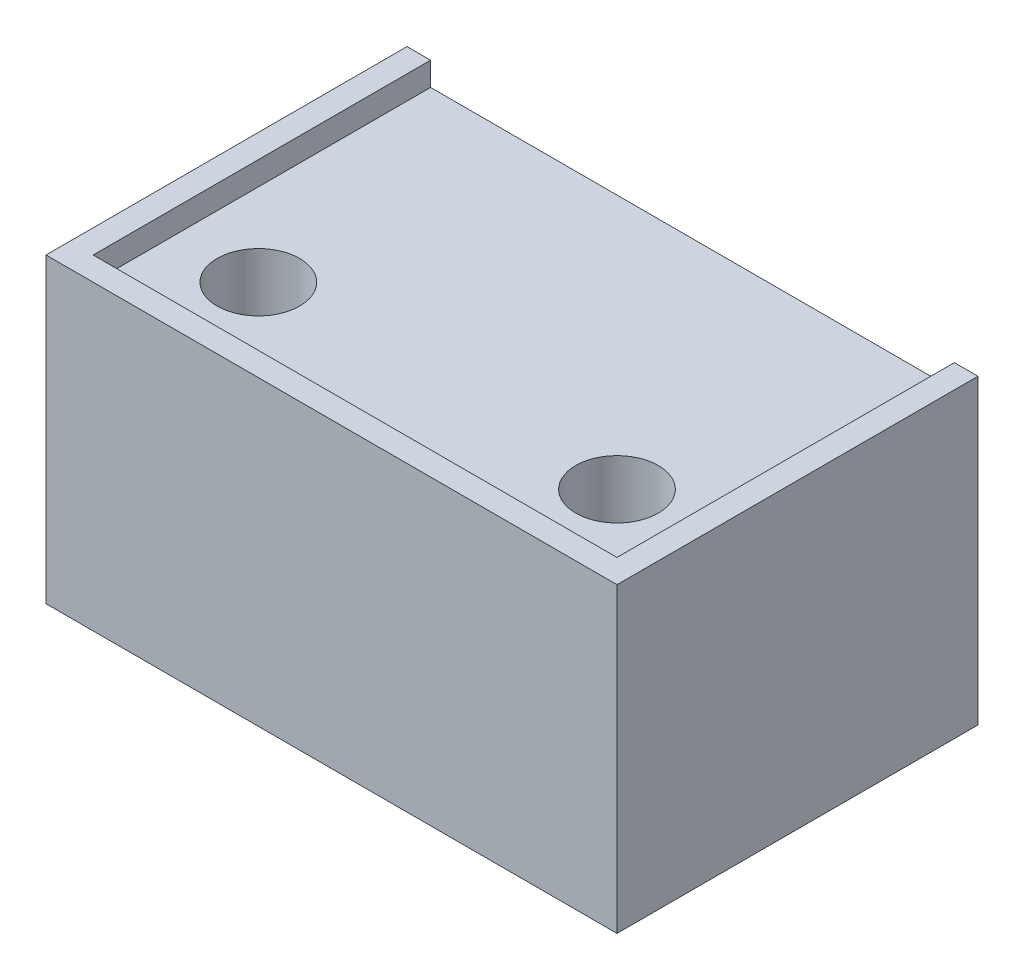
from build123d import *

# Parameters (mm, degrees)
SKETCH1_W           = 22.2
SKETCH1_H           = 14.3
SKETCH1_R           = 1.75
BOSS_EXTRUDE1_DEPTH = 11.8
BOSS_EXTRUDE2_DEPTH = 12.8


with BuildPart() as part:
    # Sketch1 → Boss-Extrude1 (new body)
    with BuildSketch(Plane(origin=(0, 0, 0), x_dir=(1, 0, 0), z_dir=(0, 1, 0))):
        with Locations((0, -0.5)):
            Rectangle(SKETCH1_W, SKETCH1_H)
        with Locations((7.6, -4.15)):
            Circle(SKETCH1_R, mode=Mode.SUBTRACT)
        with Locations((-7.6, -4.15)):
            Circle(SKETCH1_R, mode=Mode.SUBTRACT)
    extrude(amount=BOSS_EXTRUDE1_DEPTH)

    # Sketch1<3> → Boss-Extrude2 (add)
    with BuildSketch(Plane(origin=(0, 0, 0), x_dir=(1, 0, 0), z_dir=(0, 1, 0))):
        Polygon((-11.1, -7.65), (-11.1, 6.65), (-12.1, 6.65), (-12.1, -8.65), (12.1, -8.65), (12.1, 6.65), (11.1, 6.65), (11.1, -7.65), align=None)
    extrude(amount=BOSS_EXTRUDE2_DEPTH)


solid = part.part
